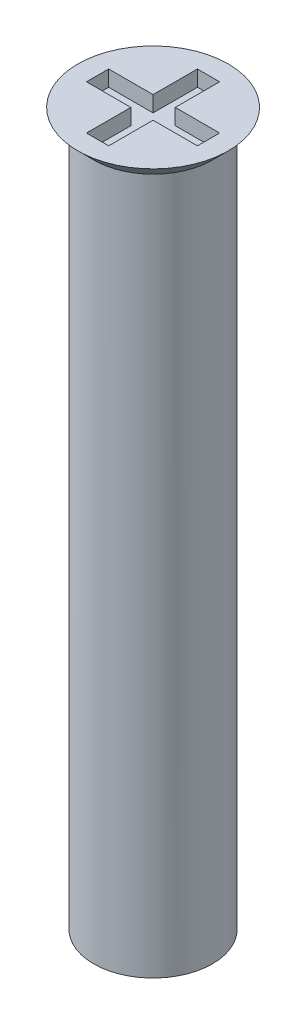
from build123d import *

# Parameters (mm, degrees)
CUT_EXTRUDE1_DEPTH = 0.2


with BuildPart() as part:
    # Sketch2 → Revolve1 (revolve)
    with BuildSketch(Plane.XY, mode=Mode.PRIVATE) as revolve1_sk:
        Polygon((0, 0), (0, 9.3), (0.95, 9.3), (0.75, 9.1), (0.75, 0.316065183), align=None)
    revolve(revolve1_sk.sketch.rotate(Axis((0, 0, 0), (0, 1, 0)), 90), axis=Axis((0, 0, 0), (0, 1, 0)))

    # Sketch3 → Cut-Extrude1 (cut)
    with BuildSketch(Plane(origin=(0, 9.3, 0), x_dir=(1, 0, 0), z_dir=(0, 1, 0))):
        Polygon((0.14, 0.14), (0.7, 0.14), (0.7, -0.14), (0.14, -0.14), (0.14, -0.7), (-0.14, -0.7), (-0.14, -0.14), (-0.7, -0.14), (-0.7, 0.14), (-0.14, 0.14), (-0.14, 0.7), (0.14, 0.7), align=None)
    extrude(amount=-CUT_EXTRUDE1_DEPTH, mode=Mode.SUBTRACT)


solid = part.part
